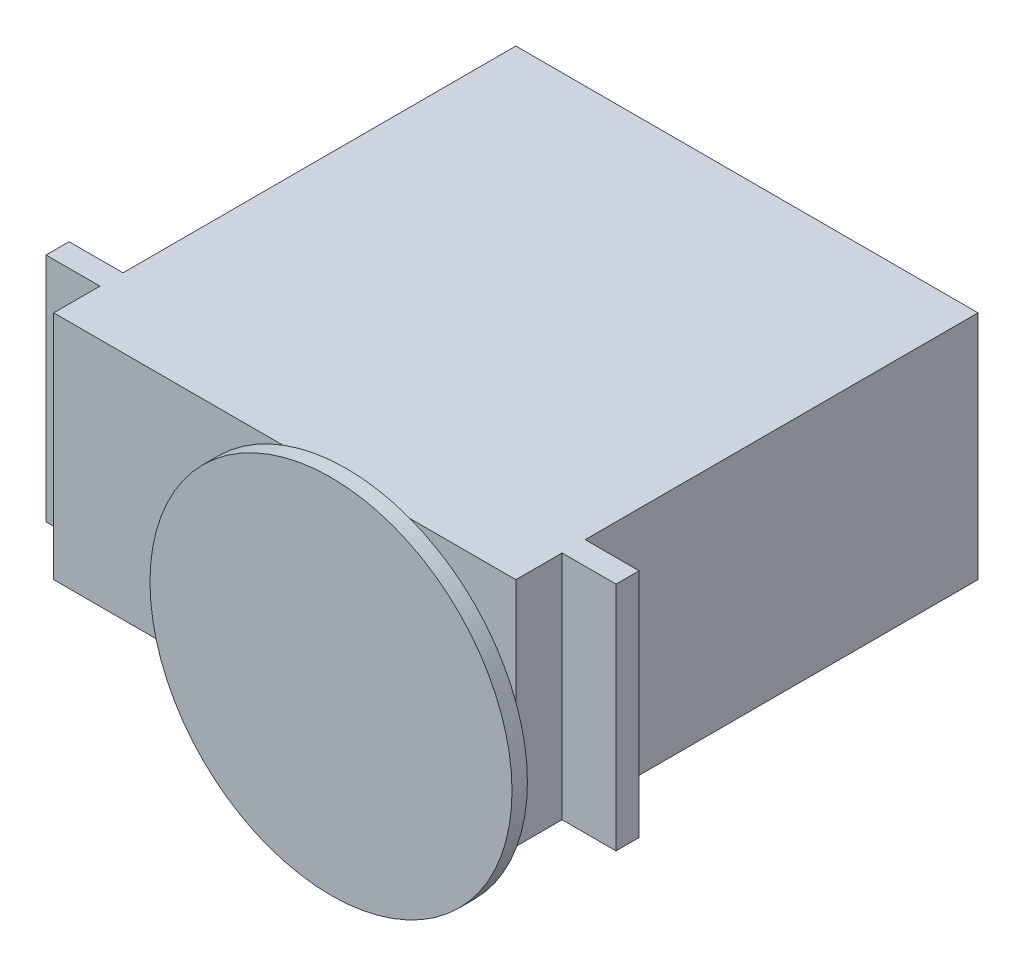
from build123d import *

# Parameters (mm, degrees)
SKETCH_1_W           = 60
SKETCH_1_H           = 60
EXTRUDE_2_DEPTH      = 30
SKETCH_3_R           = 3.5
EXTRUDE_3_DEPTH      = 7
SKETCH_4_R           = 23.5
EXTRUDE_4_DEPTH      = 2
EXTRUDE_5_DEPTH      = 7
EXTRUDE_5_DEPTH_BACK = 67
SKETCH_5_W           = 3
SKETCH_5_H           = 30


with BuildPart() as part:
    # 草图1 → 凸台-拉伸2 (new body)
    with BuildSketch(Plane(origin=(0, 0, 0), x_dir=(1, 0, 0), z_dir=(0, 1, 0))):
        Rectangle(SKETCH_1_W, SKETCH_1_H)
    extrude(amount=EXTRUDE_2_DEPTH)

    # 草图3 → 凸台-拉伸3 (add)
    with BuildSketch(Plane.XY.offset(30)):
        with Locations(Location((15, 15, 0), (0, 0, 180))):
            Circle(SKETCH_3_R)
    extrude(amount=EXTRUDE_3_DEPTH)

    # 草图4 → 凸台-拉伸4 (add)
    with BuildSketch(Plane.XY.offset(37)):
        with Locations((15, 15)):
            Circle(SKETCH_4_R)
    extrude(amount=EXTRUDE_4_DEPTH)

    # 草图5 → 凸台-拉伸5 (add, two sides: drawn at the far end of the back side and taken through both)
    with BuildSketch(Plane(origin=(30, 0, 0), x_dir=(0, 0, -1), z_dir=(1, 0, 0)).offset(-EXTRUDE_5_DEPTH_BACK)):
        with Locations((-22.5, 15)):
            Rectangle(SKETCH_5_W, SKETCH_5_H)
    extrude(amount=EXTRUDE_5_DEPTH + EXTRUDE_5_DEPTH_BACK)


solid = part.part
